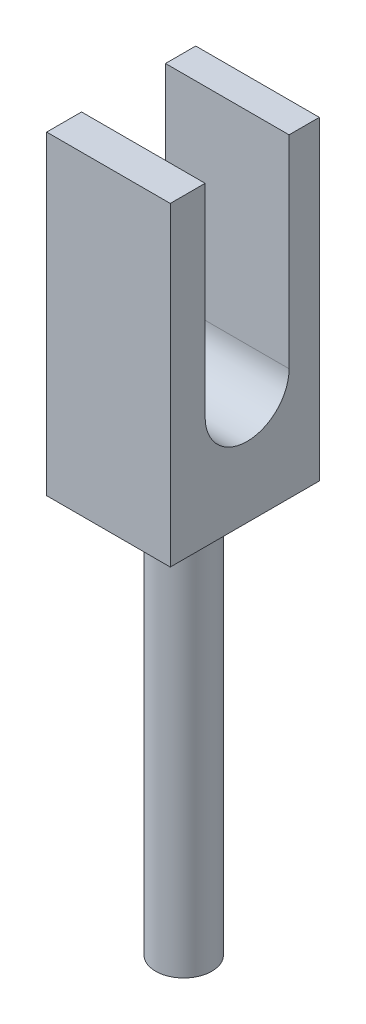
from build123d import *

# Parameters (mm, degrees)
SKETCH1_W           = 74.757250499
SKETCH1_H           = 56.340774555
BOSS_EXTRUDE1_DEPTH = 61.976
SKETCH2_R           = 21.051545166
CUT_EXTRUDE1_DEPTH  = 61.976
SKETCH3_W           = 61.976
SKETCH3_H           = 17.482215828
BOSS_EXTRUDE2_DEPTH = 101.6
SKETCH4_R           = 14.091408647
BOSS_EXTRUDE3_DEPTH = 203.2
SKETCH5_W           = 61.976
SKETCH5_H           = 15.17194434
BOSS_EXTRUDE4_DEPTH = 101.6


with BuildPart() as part:
    # Sketch1 → Boss-Extrude1 (new body)
    with BuildSketch(Plane(origin=(0, 0, 0), x_dir=(0, 0, -1), z_dir=(1, 0, 0))):
        with Locations((37.37862525, 28.170387278)):
            Rectangle(SKETCH1_W, SKETCH1_H)
    extrude(amount=BOSS_EXTRUDE1_DEPTH)

    # Sketch2 → Cut-Extrude1 (cut)
    with BuildSketch(Plane(origin=(61.976, 0, 0), x_dir=(0, 0, -1), z_dir=(1, 0, 0))):
        with Locations((38.533760994, 56.340774555)):
            Circle(SKETCH2_R)
    extrude(amount=-CUT_EXTRUDE1_DEPTH, mode=Mode.SUBTRACT)

    # Sketch3 → Boss-Extrude2 (add)
    with BuildSketch(Plane(origin=(0, 56.340774555, 0), x_dir=(1, 0, 0), z_dir=(0, 1, 0))):
        with Locations((30.988, 8.741107914)):
            Rectangle(SKETCH3_W, SKETCH3_H)
    extrude(amount=BOSS_EXTRUDE2_DEPTH)

    # Sketch4 → Boss-Extrude3 (add)
    with BuildSketch(Plane.XZ):
        with Locations(Location((30.69138806, -38.046002115, 0), (0, 0, 90))):
            Circle(SKETCH4_R)
    extrude(amount=BOSS_EXTRUDE3_DEPTH)

    # Sketch5 → Boss-Extrude4 (add)
    with BuildSketch(Plane(origin=(0, 56.340774555, 0), x_dir=(1, 0, 0), z_dir=(0, 1, 0))):
        with Locations((30.988, 67.171278329)):
            Rectangle(SKETCH5_W, SKETCH5_H)
    extrude(amount=BOSS_EXTRUDE4_DEPTH)


solid = part.part
